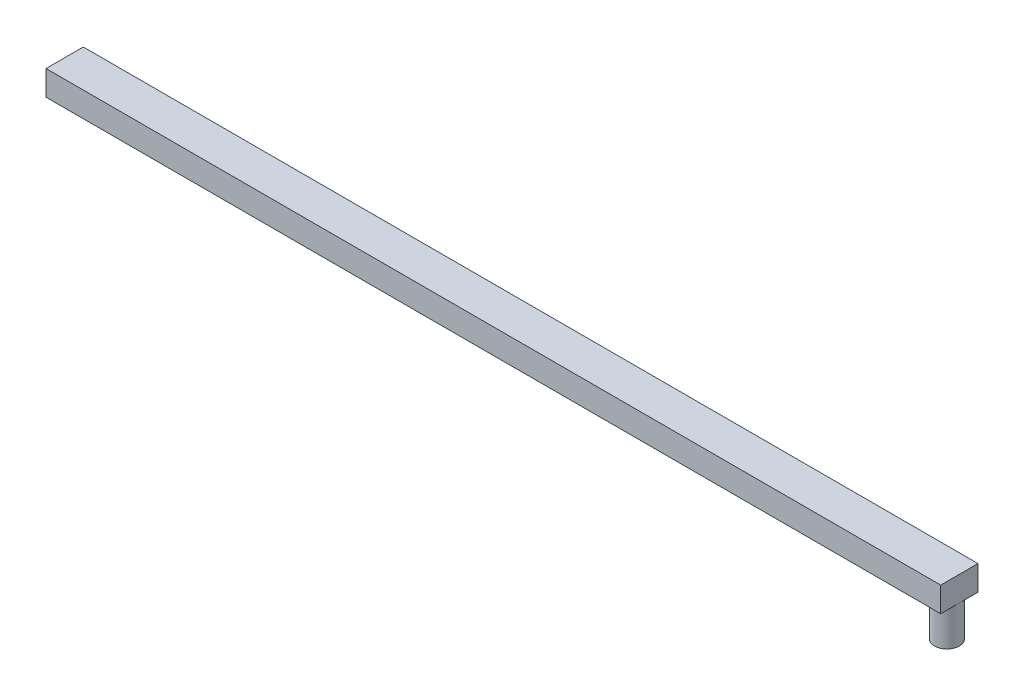
from build123d import *

# Parameters (mm, degrees)
SKETCH1_R           = 1
BOSS_EXTRUDE1_DEPTH = 3
SKETCH2_W           = 72
SKETCH2_H           = 3
BOSS_EXTRUDE2_DEPTH = 2
SKETCH3_R           = 0.5
CUT_EXTRUDE6_DEPTH  = 1


with BuildPart() as part:
    # Sketch1 → Boss-Extrude1 (new body)
    with BuildSketch(Plane(origin=(0, 0, 0), x_dir=(1, 0, 0), z_dir=(0, 1, 0))):
        with Locations(Location((0, 0, 0), (0, 0, 270))):
            Circle(SKETCH1_R)
    extrude(amount=BOSS_EXTRUDE1_DEPTH)

    # Sketch2 → Boss-Extrude2 (add)
    with BuildSketch(Plane(origin=(0, 3, 0), x_dir=(1, 0, 0), z_dir=(0, 1, 0))):
        with Locations((-35, 0)):
            Rectangle(SKETCH2_W, SKETCH2_H)
    extrude(amount=BOSS_EXTRUDE2_DEPTH)

    # Sketch3 → Cut-Extrude6 (cut)
    with BuildSketch(Plane.XZ.offset(-3)):
        with Locations(Location((-70, 0, 0), (0, 0, 270))):
            Circle(SKETCH3_R)
    extrude(amount=-CUT_EXTRUDE6_DEPTH, mode=Mode.SUBTRACT)


solid = part.part
